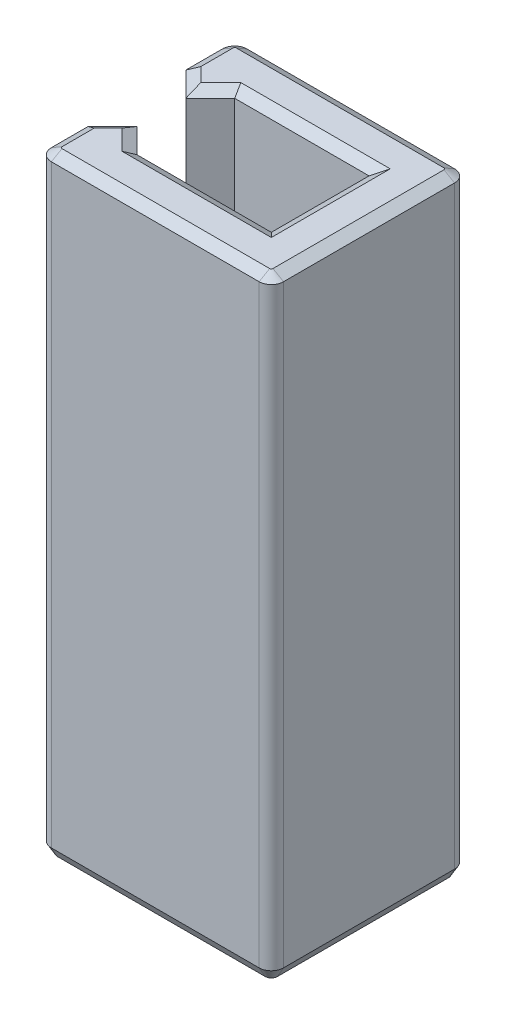
from build123d import *
from OCP.BRepFilletAPI import BRepFilletAPI_MakeChamfer

# Parameters (mm, degrees)
SALIENTE_EXTRUIR2_DEPTH = 50
CHAFL_N1_SIZE           = 0.5
CHAFL_N1_SIZE2          = 0.866025404


with BuildPart() as part:
    # Croquis1 → Saliente-Extruir2 (new body)
    with BuildSketch(Plane(origin=(0, 0, 0), x_dir=(1, 0, 0), z_dir=(0, 1, 0))):
        with BuildLine():
            Line((-5.5, 4), (-7.5, 2))
            Line((-7.5, 2), (-9.5, 4))
            Line((-9.5, 4), (-9.5, 7))
            ThreePointArc((-9.5, 7), (-9.207106781, 7.707106781), (-8.5, 8))
            Line((-8.5, 8), (8.5, 8))
            ThreePointArc((8.5, 8), (9.207106781, 7.707106781), (9.5, 7))
            Line((9.5, 7), (9.5, -7))
            ThreePointArc((9.5, -7), (9.207106781, -7.707106781), (8.5, -8))
            Line((8.5, -8), (-8.5, -8))
            ThreePointArc((-8.5, -8), (-9.207106781, -7.707106781), (-9.5, -7))
            Line((-9.5, -7), (-9.5, -4))
            Line((-9.5, -4), (-7.5, -2))
            Line((-7.5, -2), (-5.5, -4))
            Line((-5.5, -4), (5.5, -4))
            Line((5.5, -4), (5.5, 4))
            Line((5.5, 4), (-5.5, 4))
        make_face()
    extrude(amount=SALIENTE_EXTRUIR2_DEPTH)

    # Chaflán1: one chamfer whose edges measure the first distance from different faces: ONE call of the kernel's chamfer builder (chamfer() names one face for all edges)
    chafl_n1_edges_1 = [part.edges().sort_by_distance(p)[0] for p in [
        (0, 50, 4),
    ]]
    chafl_n1_side_1 = [part.faces().sort_by_distance(p)[0] for p in [
        (0, 25, 4),
    ]]
    chafl_n1_edges_2 = [part.edges().sort_by_distance(p)[0] for p in [
        (-6.5, 50, 3),
    ]]
    chafl_n1_side_2 = [part.faces().sort_by_distance(p)[0] for p in [
        (-6.5, 25, 3),
    ]]
    chafl_n1_edges_3 = [part.edges().sort_by_distance(p)[0] for p in [
        (-6.5, 0, -3),
        (-8.5, 0, -3),
        (-9.5, 0, -5.5),
        (-9.207106781, 0, -7.707106781),
        (0, 0, -8),
        (9.207106781, 0, -7.707106781),
        (9.5, 0, 0),
        (9.207106781, 0, 7.707106781),
        (0, 0, 8),
        (-9.207106781, 0, 7.707106781),
        (-9.5, 0, 5.5),
        (-8.5, 0, 3),
        (-6.5, 0, 3),
        (0, 0, 4),
        (5.5, 0, 0),
        (0, 0, -4),
    ]]
    chafl_n1_side_3 = [part.faces().sort_by_distance(p)[0] for p in [
        (-9.0314651, 0, 7.5314651),
    ]]
    chafl_n1_edges_4 = [part.edges().sort_by_distance(p)[0] for p in [
        (-8.5, 50, 3),
    ]]
    chafl_n1_side_4 = [part.faces().sort_by_distance(p)[0] for p in [
        (-8.5, 25, 3),
    ]]
    chafl_n1_edges_5 = [part.edges().sort_by_distance(p)[0] for p in [
        (-9.5, 50, 5.5),
    ]]
    chafl_n1_side_5 = [part.faces().sort_by_distance(p)[0] for p in [
        (-9.5, 25, 5.5),
    ]]
    chafl_n1_edges_6 = [part.edges().sort_by_distance(p)[0] for p in [
        (-9.207106781, 50, 7.707106781),
    ]]
    chafl_n1_side_6 = [part.faces().sort_by_distance(p)[0] for p in [
        (-9.207106781, 25, 7.707106781),
    ]]
    chafl_n1_edges_7 = [part.edges().sort_by_distance(p)[0] for p in [
        (0, 50, 8),
    ]]
    chafl_n1_side_7 = [part.faces().sort_by_distance(p)[0] for p in [
        (0, 25, 8),
    ]]
    chafl_n1_edges_8 = [part.edges().sort_by_distance(p)[0] for p in [
        (9.207106781, 50, 7.707106781),
    ]]
    chafl_n1_side_8 = [part.faces().sort_by_distance(p)[0] for p in [
        (9.207106781, 25, 7.707106781),
    ]]
    chafl_n1_edges_9 = [part.edges().sort_by_distance(p)[0] for p in [
        (9.5, 50, 0),
    ]]
    chafl_n1_side_9 = [part.faces().sort_by_distance(p)[0] for p in [
        (9.5, 25, 0),
    ]]
    chafl_n1_edges_10 = [part.edges().sort_by_distance(p)[0] for p in [
        (9.207106781, 50, -7.707106781),
    ]]
    chafl_n1_side_10 = [part.faces().sort_by_distance(p)[0] for p in [
        (9.207106781, 25, -7.707106781),
    ]]
    chafl_n1_edges_11 = [part.edges().sort_by_distance(p)[0] for p in [
        (0, 50, -8),
    ]]
    chafl_n1_side_11 = [part.faces().sort_by_distance(p)[0] for p in [
        (0, 25, -8),
    ]]
    chafl_n1_edges_12 = [part.edges().sort_by_distance(p)[0] for p in [
        (0, 50, -4),
    ]]
    chafl_n1_side_12 = [part.faces().sort_by_distance(p)[0] for p in [
        (0, 25, -4),
    ]]
    chafl_n1_edges_13 = [part.edges().sort_by_distance(p)[0] for p in [
        (-9.207106781, 50, -7.707106781),
    ]]
    chafl_n1_side_13 = [part.faces().sort_by_distance(p)[0] for p in [
        (-9.207106781, 25, -7.707106781),
    ]]
    chafl_n1_edges_14 = [part.edges().sort_by_distance(p)[0] for p in [
        (-9.5, 50, -5.5),
    ]]
    chafl_n1_side_14 = [part.faces().sort_by_distance(p)[0] for p in [
        (-9.5, 25, -5.5),
    ]]
    chafl_n1_edges_15 = [part.edges().sort_by_distance(p)[0] for p in [
        (-8.5, 50, -3),
    ]]
    chafl_n1_side_15 = [part.faces().sort_by_distance(p)[0] for p in [
        (-8.5, 25, -3),
    ]]
    chafl_n1_edges_16 = [part.edges().sort_by_distance(p)[0] for p in [
        (-6.5, 50, -3),
    ]]
    chafl_n1_side_16 = [part.faces().sort_by_distance(p)[0] for p in [
        (-6.5, 25, -3),
    ]]
    chafl_n1_edges_17 = [part.edges().sort_by_distance(p)[0] for p in [
        (5.5, 50, 0),
    ]]
    chafl_n1_side_17 = [part.faces().sort_by_distance(p)[0] for p in [
        (5.5, 25, 0),
    ]]
    chafl_n1 = BRepFilletAPI_MakeChamfer(part.part.solid().wrapped)
    for e in chafl_n1_edges_1:
        chafl_n1.Add(CHAFL_N1_SIZE, CHAFL_N1_SIZE2, e.wrapped, chafl_n1_side_1[0].wrapped)  # the first distance lies on this face
    for e in chafl_n1_edges_2:
        chafl_n1.Add(CHAFL_N1_SIZE, CHAFL_N1_SIZE2, e.wrapped, chafl_n1_side_2[0].wrapped)  # the first distance lies on this face
    for e in chafl_n1_edges_3:
        chafl_n1.Add(CHAFL_N1_SIZE, CHAFL_N1_SIZE2, e.wrapped, chafl_n1_side_3[0].wrapped)  # the first distance lies on this face
    for e in chafl_n1_edges_4:
        chafl_n1.Add(CHAFL_N1_SIZE, CHAFL_N1_SIZE2, e.wrapped, chafl_n1_side_4[0].wrapped)  # the first distance lies on this face
    for e in chafl_n1_edges_5:
        chafl_n1.Add(CHAFL_N1_SIZE, CHAFL_N1_SIZE2, e.wrapped, chafl_n1_side_5[0].wrapped)  # the first distance lies on this face
    for e in chafl_n1_edges_6:
        chafl_n1.Add(CHAFL_N1_SIZE, CHAFL_N1_SIZE2, e.wrapped, chafl_n1_side_6[0].wrapped)  # the first distance lies on this face
    for e in chafl_n1_edges_7:
        chafl_n1.Add(CHAFL_N1_SIZE, CHAFL_N1_SIZE2, e.wrapped, chafl_n1_side_7[0].wrapped)  # the first distance lies on this face
    for e in chafl_n1_edges_8:
        chafl_n1.Add(CHAFL_N1_SIZE, CHAFL_N1_SIZE2, e.wrapped, chafl_n1_side_8[0].wrapped)  # the first distance lies on this face
    for e in chafl_n1_edges_9:
        chafl_n1.Add(CHAFL_N1_SIZE, CHAFL_N1_SIZE2, e.wrapped, chafl_n1_side_9[0].wrapped)  # the first distance lies on this face
    for e in chafl_n1_edges_10:
        chafl_n1.Add(CHAFL_N1_SIZE, CHAFL_N1_SIZE2, e.wrapped, chafl_n1_side_10[0].wrapped)  # the first distance lies on this face
    for e in chafl_n1_edges_11:
        chafl_n1.Add(CHAFL_N1_SIZE, CHAFL_N1_SIZE2, e.wrapped, chafl_n1_side_11[0].wrapped)  # the first distance lies on this face
    for e in chafl_n1_edges_12:
        chafl_n1.Add(CHAFL_N1_SIZE, CHAFL_N1_SIZE2, e.wrapped, chafl_n1_side_12[0].wrapped)  # the first distance lies on this face
    for e in chafl_n1_edges_13:
        chafl_n1.Add(CHAFL_N1_SIZE, CHAFL_N1_SIZE2, e.wrapped, chafl_n1_side_13[0].wrapped)  # the first distance lies on this face
    for e in chafl_n1_edges_14:
        chafl_n1.Add(CHAFL_N1_SIZE, CHAFL_N1_SIZE2, e.wrapped, chafl_n1_side_14[0].wrapped)  # the first distance lies on this face
    for e in chafl_n1_edges_15:
        chafl_n1.Add(CHAFL_N1_SIZE, CHAFL_N1_SIZE2, e.wrapped, chafl_n1_side_15[0].wrapped)  # the first distance lies on this face
    for e in chafl_n1_edges_16:
        chafl_n1.Add(CHAFL_N1_SIZE, CHAFL_N1_SIZE2, e.wrapped, chafl_n1_side_16[0].wrapped)  # the first distance lies on this face
    for e in chafl_n1_edges_17:
        chafl_n1.Add(CHAFL_N1_SIZE, CHAFL_N1_SIZE2, e.wrapped, chafl_n1_side_17[0].wrapped)  # the first distance lies on this face
    add(Compound.cast(chafl_n1.Shape()), mode=Mode.REPLACE)


solid = part.part
